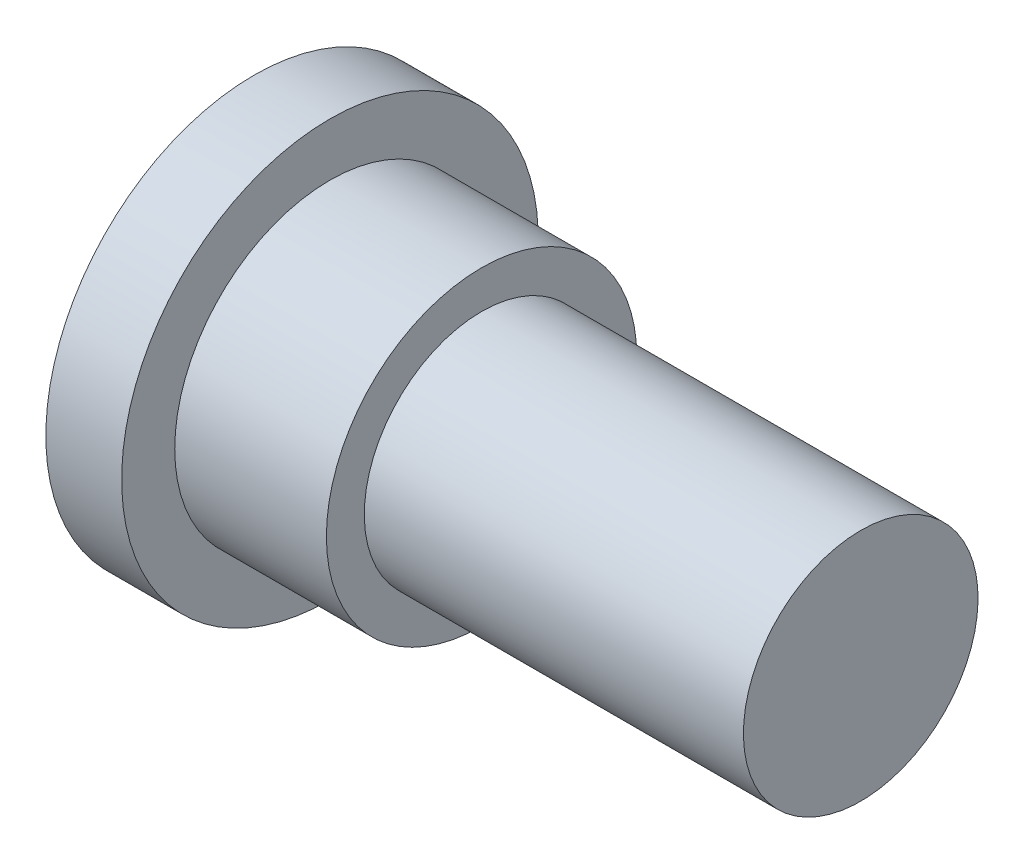
from build123d import *


with BuildPart() as part:
    # Sketch1 → Revolve1 (revolve)
    with BuildSketch(Plane.XY):
        Polygon((0, 0), (0, 27.470569075), (10, 27.470569075), (10, 20.470569075), (30, 20.470569075), (30, 15.470569075), (80, 15.470569075), (80, 0), align=None)
    revolve(axis=Axis((80, 0, 0), (-1, 0, 0)))


solid = part.part
